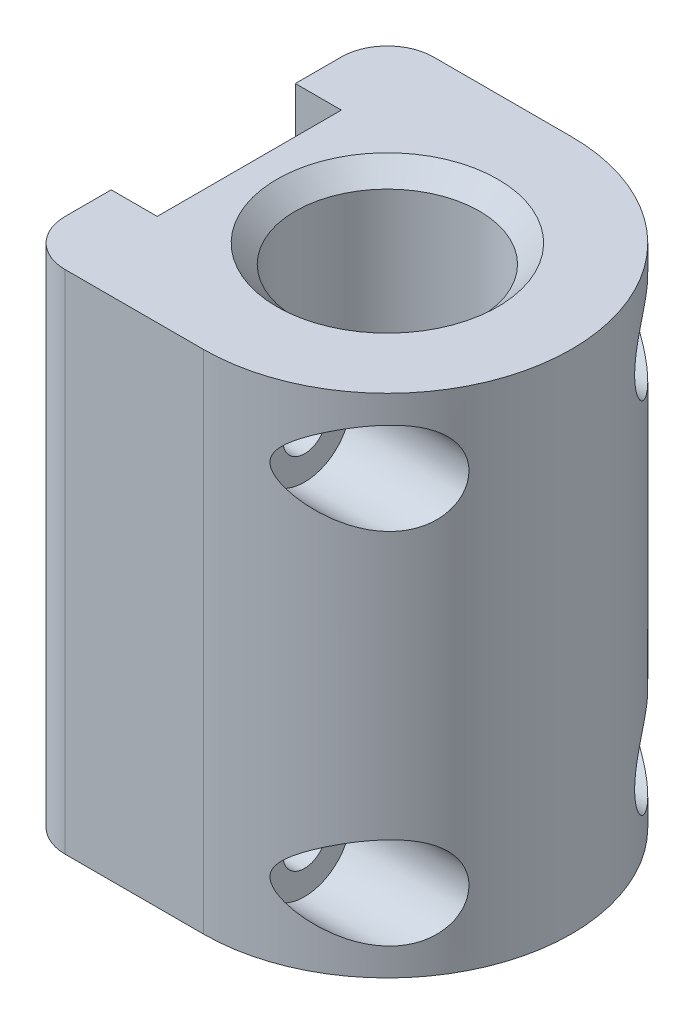
from build123d import *

# Parameters (mm, degrees)
BOSS_EXTRUDE1_DEPTH        = 13.97
SKETCH2_R                  = 2.54
CUT_EXTRUDE1_DEPTH         = 10.16
CUT_EXTRUDE3_START         = 6.35
SKETCH4_R                  = 1.27
CUT_EXTRUDE3_DEPTH         = 5.08
FILLET2_R                  = 1.27
CHAMFER2_SIZE              = 0.508
SCALE1_SCALE               = 1.5
F_50_0_07_DIAMETER_HOLE1_D = 1.778


with BuildPart() as part:
    # Sketch1 → Boss-Extrude1 (new body)
    with BuildSketch(Plane(origin=(0, 0, 0), x_dir=(1, 0, 0), z_dir=(0, 1, 0))):
        with BuildLine():
            Line((-5.08, 2.54), (-3.81, 2.54))
            Line((-3.81, 2.54), (-3.81, -2.54))
            Line((-3.81, -2.54), (-5.08, -2.54))
            Line((-5.08, -2.54), (-5.08, -5.08))
            Line((-5.08, -5.08), (0, -5.08))
            ThreePointArc((0, -5.08), (5.08, 0), (0, 5.08))
            Line((0, 5.08), (-5.08, 5.08))
            Line((-5.08, 5.08), (-5.08, 2.54))
        make_face()
    extrude(amount=BOSS_EXTRUDE1_DEPTH)

    # Sketch2 → Cut-Extrude1 (cut)
    with BuildSketch(Plane(origin=(0, 13.97, 0), x_dir=(1, 0, 0), z_dir=(0, 1, 0))):
        with Locations(Location((0, 0, 0), (0, 0, 270))):
            Circle(SKETCH2_R)
    extrude(amount=-CUT_EXTRUDE1_DEPTH, mode=Mode.SUBTRACT)

    # Sketch4 → Cut-Extrude3 (cut)
    with BuildSketch(Plane(origin=(0, 0, 0), x_dir=(0, 0, -1), z_dir=(1, 0, 0)).offset(CUT_EXTRUDE3_START)):
        with Locations((-3.556, 2.032)):
            Circle(SKETCH4_R)
        with Locations((3.556, 2.032)):
            Circle(SKETCH4_R)
        with Locations((-3.556, 11.938)):
            Circle(SKETCH4_R)
        with Locations((3.556, 11.938)):
            Circle(SKETCH4_R)
    extrude(amount=-CUT_EXTRUDE3_DEPTH, mode=Mode.SUBTRACT)

    # Fillet2
    fillet2_edges = [part.edges().sort_by_distance(p)[0] for p in [
        (-5.08, 6.985, -5.08),
        (-5.08, 6.985, 5.08),
    ]]
    fillet(fillet2_edges, radius=FILLET2_R)

    # Chamfer2
    chamfer2_edges = [part.edges().sort_by_distance(p)[0] for p in [
        (0, 13.97, -2.54),
    ]]
    chamfer(chamfer2_edges, length=CHAMFER2_SIZE)


with BuildPart() as part_1:
    # Scale1: scaled about (-0.295942874, 6.548984476, -4.0012e-05)
    add(part.part.scale(SCALE1_SCALE).moved(Location((0.147971437, -3.274492238, 2.0006e-05))))

    # #50 (0.07) Diameter Hole1 (through all)
    with Locations(Plane(origin=(2.052964344, 0, 0), x_dir=(0, 0, -1), z_dir=(1, 0, 0))):
        with Locations((-5.334026182, -0.226506275), (5.333973818, -0.226506275), (5.333973818, 14.632493725), (-5.334026182, 14.632493725)):
            Hole(F_50_0_07_DIAMETER_HOLE1_D / 2)


solid = part_1.part
